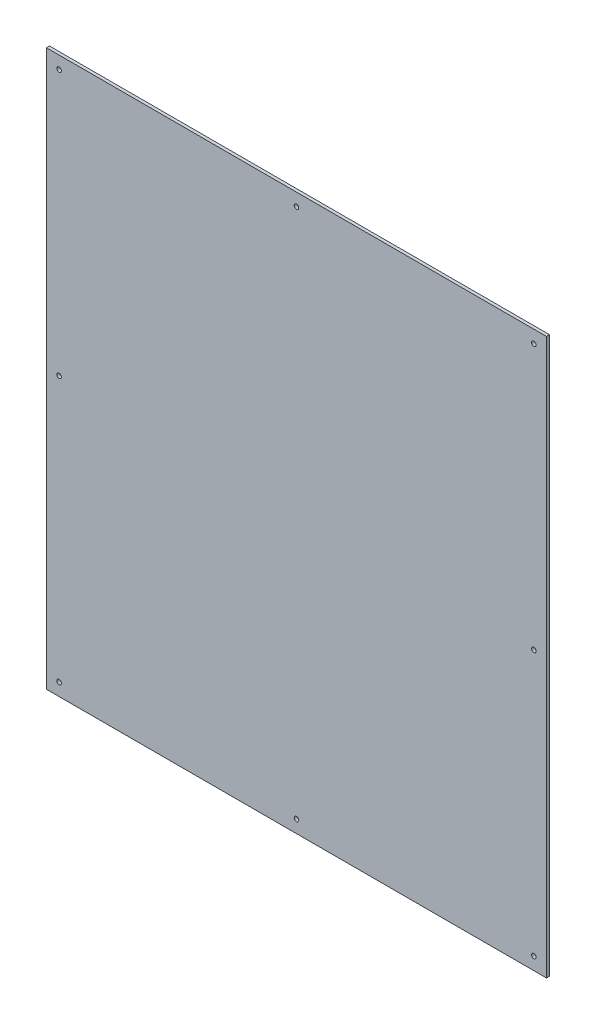
from build123d import *

# Parameters (mm, degrees)
SKETCH1_W            = 495
SKETCH1_H            = 550
BOSS_EXTRUDE1_DEPTH  = 3
M4_CLEARANCE_HOLE1_D = 4.5


with BuildPart() as part:
    # Sketch1 → Boss-Extrude1 (new body)
    with BuildSketch(Plane.XY):
        with Locations((247.5, 275)):
            Rectangle(SKETCH1_W, SKETCH1_H)
    extrude(amount=BOSS_EXTRUDE1_DEPTH)

    # M4 Clearance Hole1 (through all)
    with Locations(Plane.XY.offset(3)):
        with Locations((12.5, 275), (12.5, 537.5), (12.5, 12.5), (247.5, 12.5), (482.5, 12.5), (482.5, 275), (482.5, 537.5), (247.5, 537.5)):
            Hole(M4_CLEARANCE_HOLE1_D / 2)


solid = part.part
